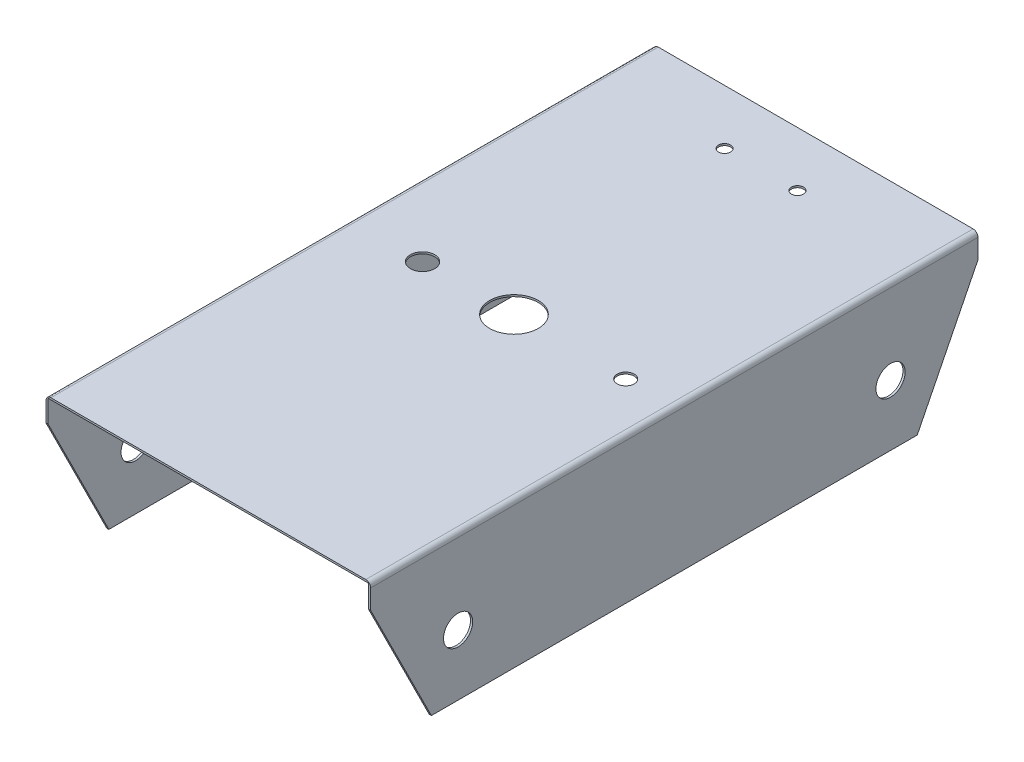
from build123d import *

# Parameters (mm, degrees)
BOSS_EXTRUDE1_DEPTH     = 250
CUT_EXTRUDE1_DEPTH      = 250
CUT_EXTRUDE2_DEPTH      = 290.7486918
CUT_EXTRUDE2_DEPTH_BACK = 290.7486918
SKETCH3_R               = 6
FILLET1_R               = 2
SKETCH5_R               = 10
CUT_EXTRUDE3_DEPTH      = 10
SKETCH6_R               = 2.5
CUT_EXTRUDE4_DEPTH      = 10
SKETCH7_R               = 3.5
SKETCH7_R_2             = 5
CUT_EXTRUDE5_DEPTH      = 10
SKETCH9_R               = 2.5
CUT_EXTRUDE8_DEPTH      = 14


with BuildPart() as part:
    # Sketch1 → Boss-Extrude1 (new body)
    with BuildSketch(Plane.XY):
        Polygon((-66.81, -60), (-66.81, 0), (66.81, 0), (66.81, -60), (65.93, -60), (65.93, -0.75), (-65.93, -0.75), (-65.93, -60), align=None)
    extrude(amount=BOSS_EXTRUDE1_DEPTH)

    # Sketch2 → Cut-Extrude1 (cut)
    with BuildSketch(Plane(origin=(66.81, 0, 0), x_dir=(0, 0, -1), z_dir=(1, 0, 0))):
        Polygon((-225, -60), (-250, -10), (-250, -60), align=None)
        Polygon((0, -10), (-25, -60), (0, -60), align=None)
    extrude(amount=-CUT_EXTRUDE1_DEPTH, mode=Mode.SUBTRACT)

    # Sketch3 → Cut-Extrude2 (cut, two sides: drawn at the far end of the back side and taken through both)
    with BuildSketch(Plane(origin=(66.81, 0, 0), x_dir=(0, 0, -1), z_dir=(1, 0, 0)).offset(-CUT_EXTRUDE2_DEPTH_BACK)):
        with Locations(Location((-214, -35, 0), (0, 0, 90))):
            Circle(SKETCH3_R)
        with Locations(Location((-36, -35, 0), (0, 0, 90))):
            Circle(SKETCH3_R)
    extrude(amount=CUT_EXTRUDE2_DEPTH + CUT_EXTRUDE2_DEPTH_BACK, mode=Mode.SUBTRACT)

    # Fillet1
    fillet1_edges = [part.edges().sort_by_distance(p)[0] for p in [
        (-66.81, 0, 125),
        (66.81, 0, 125),
    ]]
    fillet(fillet1_edges, radius=FILLET1_R)

    # Sketch5 → Cut-Extrude3 (cut)
    with BuildSketch(Plane(origin=(0, 0, 0), x_dir=(1, 0, 0), z_dir=(0, 1, 0))):
        with Locations(Location((0.81, -125, 0), (0, 0, 180))):
            Circle(SKETCH5_R)
    extrude(amount=-CUT_EXTRUDE3_DEPTH, mode=Mode.SUBTRACT)

    # Sketch6 → Cut-Extrude4 (cut)
    with BuildSketch(Plane(origin=(-65.93, 0, 0), x_dir=(0, 0, -1), z_dir=(1, 0, 0))):
        with Locations(Location((-173, -55.7, 0), (0, 0, 90))):
            Circle(SKETCH6_R)
        with Locations(Location((-93, -55.7, 0), (0, 0, 90))):
            Circle(SKETCH6_R)
        with Locations(Location((-93, -5.7, 0), (0, 0, 90))):
            Circle(SKETCH6_R)
        with Locations(Location((-173, -5.7, 0), (0, 0, 90))):
            Circle(SKETCH6_R)
    extrude(amount=-CUT_EXTRUDE4_DEPTH, mode=Mode.SUBTRACT)

    # Sketch7 → Cut-Extrude5 (cut)
    with BuildSketch(Plane(origin=(0, 0, 0), x_dir=(1, 0, 0), z_dir=(0, 1, 0))):
        with Locations(Location((46.81, -125, 0), (0, 0, 180))):
            Circle(SKETCH7_R)
        with Locations(Location((-36.81, -125, 0), (0, 0, 180))):
            Circle(SKETCH7_R_2)
    extrude(amount=-CUT_EXTRUDE5_DEPTH, mode=Mode.SUBTRACT)

    # Sketch9 → Cut-Extrude8 (cut)
    with BuildSketch(Plane(origin=(0, 0, 0), x_dir=(1, 0, 0), z_dir=(0, 1, 0))):
        with Locations(Location((-15, -22.5, 0), (0, 0, 180))):
            Circle(SKETCH9_R)
        with Locations(Location((15, -22.5, 0), (0, 0, 180))):
            Circle(SKETCH9_R)
    extrude(amount=-CUT_EXTRUDE8_DEPTH, mode=Mode.SUBTRACT)


solid = part.part
